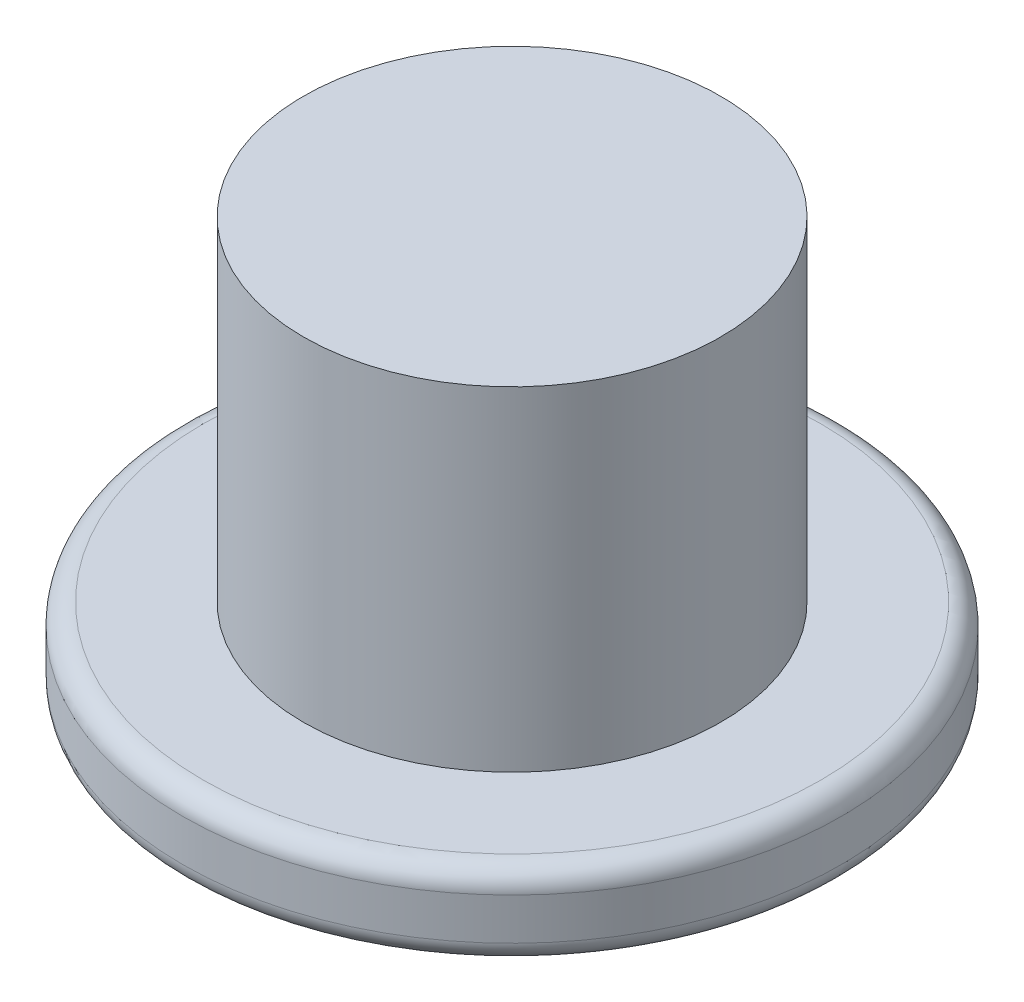
from build123d import *

# Parameters (mm, degrees)
SKETCH1_R           = 7.9
BOSS_EXTRUDE5_DEPTH = 2
SKETCH4_R           = 5
BOSS_EXTRUDE6_DEPTH = 8
CUT_EXTRUDE2_DEPTH  = 0.5
FILLET1_R           = 0.5


with BuildPart() as part:
    # Sketch1 → Boss-Extrude5 (new body)
    with BuildSketch(Plane(origin=(0, 0, 0), x_dir=(1, 0, 0), z_dir=(0, 1, 0))):
        with Locations(Location((-5.408676197, -40.3067379, 0), (0, 0, 270))):
            Circle(SKETCH1_R)
    extrude(amount=BOSS_EXTRUDE5_DEPTH)

    # Sketch4 → Boss-Extrude6 (add)
    with BuildSketch(Plane(origin=(0, 2, 0), x_dir=(1, 0, 0), z_dir=(0, 1, 0))):
        with Locations(Location((-5.408676197, -40.3067379, 0), (0, 0, 270))):
            Circle(SKETCH4_R)
    extrude(amount=BOSS_EXTRUDE6_DEPTH)

    # Sketch5 → Cut-Extrude2 (cut)
    # profile 1 of 2: a face of its own
    with BuildSketch(Plane.XZ):
        with BuildLine():
            Line((-7.395203366, 36.627743896), (-9.326626978, 36.627743896))
            add(Edge.make_bspline(
                [(-9.326626978, 36.627743896), (-9.398611671, 36.62893953), (-9.533540035, 36.63118063), (-9.721593732, 36.659531953), (-9.882699019, 36.700057347), (-10.015508651, 36.762849953), (-10.119951422, 36.844172385), (-10.194282182, 36.945790106), (-10.239550119, 37.065431561), (-10.244297474, 37.151545338), (-10.246765866, 37.196320285)],
                knots=[0, 0, 0, 0, 1.415135186, 2.652534404, 3.734544985, 4.672554218, 5.523260805, 6.310976397, 7.121790439, 8, 8, 8, 8], degree=3))
            add(Edge.make_bspline(
                [(-10.246765866, 37.196320285), (-10.243998068, 37.246880508), (-10.238727183, 37.343165345), (-10.190466013, 37.478040113), (-10.109170063, 37.591156604), (-9.997108837, 37.684714193), (-9.852543086, 37.753164788), (-9.678816187, 37.800974761), (-9.475221022, 37.831046758), (-9.329154177, 37.834140777), (-9.251395496, 37.835787878)],
                knots=[0, 0, 0, 0, 0.905373615, 1.724156773, 2.531277661, 3.379243946, 4.316186145, 5.379299071, 6.604869919, 8, 8, 8, 8], degree=3))
            add(Edge.make_bspline(
                [(-9.251395496, 37.835787878), (-9.218118037, 37.835402612), (-9.148660368, 37.834598475), (-9.079228785, 37.832526752), (-9.043062163, 37.8314476)],
                knots=[0, 0, 0, 0, 0.958208341, 2, 2, 2, 2], degree=3))
            Line((-9.043062163, 37.8314476), (-9.043062163, 42.197767044))
            add(Edge.make_bspline(
                [(-9.043062163, 42.197767044), (-9.07627195, 42.175000143), (-9.139049321, 42.131963245), (-9.229094296, 42.072453597), (-9.309400306, 42.020923773), (-9.382525953, 41.981744301), (-9.443562018, 41.946182155), (-9.498315187, 41.925698888), (-9.542641421, 41.908633246), (-9.570539937, 41.906466396), (-9.582703366, 41.905521674)],
                knots=[0, 0, 0, 0, 1.561944787, 2.952587071, 4.188085884, 5.260224314, 6.172561158, 6.919514454, 7.528920812, 8, 8, 8, 8], degree=3))
            add(Edge.make_bspline(
                [(-9.582703366, 41.905521674), (-9.62586971, 41.907605368), (-9.711372722, 41.911732708), (-9.834918282, 41.94913907), (-9.948331823, 42.012265616), (-10.051370455, 42.094846168), (-10.136897763, 42.194706044), (-10.201251731, 42.304579929), (-10.238775777, 42.423507764), (-10.244085151, 42.505192968), (-10.246765866, 42.546436026)],
                knots=[0, 0, 0, 0, 1.013852114, 2.008217582, 3.003359493, 4.052344806, 5.098380764, 6.079255836, 7.0302116, 8, 8, 8, 8], degree=3))
            add(Edge.make_bspline(
                [(-10.246765866, 42.546436026), (-10.242626904, 42.591950737), (-10.23399707, 42.686849964), (-10.165596234, 42.824961933), (-10.062703976, 42.963842747), (-9.971644073, 43.047104267), (-9.922691792, 43.091864267)],
                knots=[0, 0, 0, 0, 0.833605739, 1.738087287, 2.784033566, 4, 4, 4, 4], degree=3))
            Line((-9.922691792, 43.091864267), (-9.377263552, 43.486829544))
            Line((-9.377263552, 43.486829544), (-8.788432533, 43.959919822))
            add(Edge.make_bspline(
                [(-8.788432533, 43.959919822), (-8.729686688, 43.999861858), (-8.617304787, 44.07627172), (-8.438392764, 44.157341312), (-8.262988102, 44.21096973), (-8.145462893, 44.217267853), (-8.088201052, 44.220336489)],
                knots=[0, 0, 0, 0, 1.121272833, 2.145015919, 3.096195581, 4, 4, 4, 4], degree=3))
            add(Edge.make_bspline(
                [(-8.088201052, 44.220336489), (-8.054268553, 44.218767965), (-7.989751621, 44.21578568), (-7.899443899, 44.19076183), (-7.821955451, 44.15016124), (-7.758821382, 44.091142413), (-7.710617094, 44.015487272), (-7.678099525, 43.923469045), (-7.657845999, 43.81611993), (-7.655451648, 43.739151052), (-7.654173274, 43.698056396)],
                knots=[0, 0, 0, 0, 1.048007274, 1.992609376, 2.873587166, 3.728544433, 4.634673172, 5.621103599, 6.729877163, 8, 8, 8, 8], degree=3))
            add(Edge.make_bspline(
                [(-7.654173274, 43.698056396), (-7.653927207, 43.647417432), (-7.65341394, 43.54179056), (-7.657652871, 43.375920499), (-7.659162961, 43.195509007), (-7.666447064, 43.000255304), (-7.670796966, 42.790400199), (-7.681031343, 42.565756009), (-7.688115451, 42.326458091), (-7.70167787, 42.070521305), (-7.710699694, 41.79316043), (-7.722015306, 41.490364183), (-7.727781096, 41.159471395), (-7.736382851, 40.800714247), (-7.73919812, 40.413426017), (-7.7448814, 39.998225068), (-7.745100584, 39.555500473), (-7.74619974, 39.251200006), (-7.746765866, 39.094468433)],
                knots=[0, 0, 0, 0, 0.527813644, 1.10095664, 1.72938664, 2.408302001, 3.137464797, 3.91720181, 4.752194944, 5.632803057, 6.588542385, 7.64475597, 8.791141156, 10.038040056, 11.38530595, 12.828075392, 14.366283368, 16, 16, 16, 16], degree=3))
            Line((-7.746765866, 39.094468433), (-7.746765866, 37.924040193))
            Line((-7.746765866, 37.924040193), (-7.415457996, 37.924040193))
            add(Edge.make_bspline(
                [(-7.415457996, 37.924040193), (-7.368446742, 37.921994347), (-7.277377999, 37.918031197), (-7.146339977, 37.881935068), (-7.02814323, 37.821911518), (-6.923972292, 37.740453761), (-6.836915042, 37.643032931), (-6.773213613, 37.531286361), (-6.735704321, 37.406990969), (-6.73078569, 37.320517914), (-6.728247348, 37.275892044)],
                knots=[0, 0, 0, 0, 1.070033963, 2.072836576, 3.070927483, 4.073730096, 5.070730524, 6.030736016, 6.983728311, 8, 8, 8, 8], degree=3))
            add(Edge.make_bspline(
                [(-6.728247348, 37.275892044), (-6.730127963, 37.231231312), (-6.733773851, 37.14464898), (-6.772424894, 37.02057837), (-6.833383292, 36.908011653), (-6.91808705, 36.810059971), (-7.018698526, 36.728685964), (-7.133933462, 36.669869158), (-7.260923667, 36.633829575), (-7.349629677, 36.629809337), (-7.395203366, 36.627743896)],
                knots=[0, 0, 0, 0, 1.030309817, 1.997428643, 2.975999118, 3.973155493, 4.973303344, 5.951301239, 6.947458459, 8, 8, 8, 8], degree=3))
        make_face()
    # profile 2 of 2: a face of its own
    with BuildSketch(Plane.XZ):
        with BuildLine():
            add(Edge.make_bspline(
                [(-2.373501978, 36.442558711), (-2.439597493, 36.443778155), (-2.569569797, 36.446176107), (-2.761008881, 36.461869905), (-2.945415788, 36.489938656), (-3.123118843, 36.52658927), (-3.293752699, 36.576294128), (-3.457321113, 36.637487871), (-3.614861491, 36.707661384), (-3.76511097, 36.789669596), (-3.908527497, 36.88154355), (-4.04322282, 36.987129363), (-4.172728308, 37.101623628), (-4.295447484, 37.227013912), (-4.41028209, 37.364433601), (-4.51844426, 37.511832363), (-4.620701389, 37.669909282), (-4.680882789, 37.781814798), (-4.711464941, 37.838681396)],
                knots=[0, 0, 0, 0, 1.101036621, 2.165113118, 3.196701619, 4.206636599, 5.185419256, 6.153861669, 7.113904655, 8.055726016, 9.002740657, 9.947572133, 10.903573382, 11.880673289, 12.867074579, 13.884141148, 14.924792093, 16, 16, 16, 16], degree=3))
            add(Edge.make_bspline(
                [(-4.711464941, 37.838681396), (-4.754896626, 37.927246315), (-4.843309325, 38.107535508), (-4.950451339, 38.395613487), (-5.041716336, 38.70215935), (-5.115902025, 39.027074458), (-5.175881335, 39.370302143), (-5.216997706, 39.732140815), (-5.241692328, 40.113122022), (-5.245048736, 40.373365538), (-5.246765866, 40.50650547)],
                knots=[0, 0, 0, 0, 0.86163265, 1.754002121, 2.682094637, 3.655395029, 4.66495959, 5.72569639, 6.83647195, 8, 8, 8, 8], degree=3))
            add(Edge.make_bspline(
                [(-5.246765866, 40.50650547), (-5.244500916, 40.6213626), (-5.240037474, 40.847706752), (-5.205963944, 41.181288579), (-5.150877531, 41.504171417), (-5.074941427, 41.816966956), (-4.974624265, 42.118651582), (-4.852312308, 42.409075952), (-4.709732377, 42.689833188), (-4.597183117, 42.867021204), (-4.540747348, 42.955868896)],
                knots=[0, 0, 0, 0, 1.065446396, 2.099630748, 3.107335507, 4.102416534, 5.082906438, 6.053454268, 7.02394022, 8, 8, 8, 8], degree=3))
            add(Edge.make_bspline(
                [(-4.540747348, 42.955868896), (-4.505109448, 43.007372484), (-4.434880474, 43.108866797), (-4.321660817, 43.252601421), (-4.203013995, 43.385682656), (-4.079434075, 43.508900115), (-3.952279485, 43.623872846), (-3.819529089, 43.728128368), (-3.680303083, 43.820815187), (-3.538597217, 43.906249973), (-3.391105199, 43.980737217), (-3.238473204, 44.043989711), (-3.081435765, 44.099751264), (-2.918491216, 44.142128623), (-2.751626122, 44.177852207), (-2.579428727, 44.201276083), (-2.402793618, 44.218733855), (-2.283365888, 44.219798634), (-2.223039015, 44.220336489)],
                knots=[0, 0, 0, 0, 1.089001194, 2.146014127, 3.179577203, 4.187716666, 5.179502559, 6.159265929, 7.119926927, 8.086463806, 9.035375073, 9.990160863, 10.958261042, 11.930674461, 12.915914311, 13.924053774, 14.951371286, 16, 16, 16, 16], degree=3))
            add(Edge.make_bspline(
                [(-2.223039015, 44.220336489), (-2.109962382, 44.217300968), (-1.888746884, 44.211362479), (-1.567260144, 44.156162969), (-1.265204003, 44.068444856), (-0.9832604, 43.944098347), (-0.720135204, 43.785223817), (-0.477870377, 43.58934066), (-0.253304827, 43.359568627), (-0.126416544, 43.183352065), (-0.061580681, 43.093311026)],
                knots=[0, 0, 0, 0, 1.065421073, 2.084317927, 3.065587267, 4.024520138, 4.981370049, 5.954971245, 6.955055573, 8, 8, 8, 8], degree=3))
            add(Edge.make_bspline(
                [(-0.061580681, 43.093311026), (-0.009538346, 43.012640523), (0.094562097, 42.851275067), (0.225908941, 42.593280582), (0.337442397, 42.323770881), (0.428885265, 42.04175424), (0.499730745, 41.747151758), (0.549777081, 41.440080052), (0.580991343, 41.121060866), (0.584689252, 40.904436739), (0.586567467, 40.794410563)],
                knots=[0, 0, 0, 0, 0.949659157, 1.899606148, 2.860462492, 3.834038165, 4.83079677, 5.856383007, 6.911229405, 8, 8, 8, 8], degree=3))
            add(Edge.make_bspline(
                [(0.586567467, 40.794410563), (0.58448588, 40.618810292), (0.580449884, 40.278338252), (0.545484412, 39.784749532), (0.488524776, 39.324766749), (0.40845338, 38.898704104), (0.304685988, 38.506273302), (0.178283526, 38.147513525), (0.027548222, 37.822634527), (-0.14567533, 37.531053439), (-0.343961564, 37.274648902), (-0.563267666, 37.0499372), (-0.809043848, 36.862308215), (-1.077136555, 36.707265062), (-1.36914741, 36.58891245), (-1.683179641, 36.503039823), (-2.020770138, 36.452242687), (-2.253727389, 36.445847028), (-2.373501978, 36.442558711)],
                knots=[0, 0, 0, 0, 1.410768719, 2.735344897, 3.97339736, 5.133070797, 6.215826799, 7.231830758, 8.185260544, 9.089012029, 9.950857309, 10.783804673, 11.604540534, 12.427350082, 13.264917127, 14.128798245, 15.03792469, 16, 16, 16, 16], degree=3))
        make_face()
        with BuildLine():
            add(Edge.make_bspline(
                [(-2.259207996, 42.924040193), (-2.323549729, 42.922145887), (-2.450491722, 42.918408549), (-2.635327546, 42.878841998), (-2.810497624, 42.817984875), (-2.976496245, 42.733545066), (-3.13018731, 42.62132395), (-3.2758714, 42.48741355), (-3.411496788, 42.328554633), (-3.489327847, 42.208855278), (-3.529462626, 42.14713047)],
                knots=[0, 0, 0, 0, 0.987720428, 1.948707218, 2.891188167, 3.832764918, 4.799652197, 5.806957348, 6.869123932, 8, 8, 8, 8], degree=3))
            add(Edge.make_bspline(
                [(-3.529462626, 42.14713047), (-3.563189394, 42.090247649), (-3.630707502, 41.976373099), (-3.715195515, 41.796348204), (-3.78821179, 41.610433114), (-3.847518602, 41.417425085), (-3.893513598, 41.217704249), (-3.927330331, 41.011429842), (-3.945647947, 40.798119122), (-3.948846322, 40.653624505), (-3.95046957, 40.580290193)],
                knots=[0, 0, 0, 0, 0.965078813, 1.932005355, 2.899623887, 3.879614671, 4.877106227, 5.890011682, 6.929132817, 8, 8, 8, 8], degree=3))
            add(Edge.make_bspline(
                [(-3.95046957, 40.580290193), (-3.950237076, 40.484787587), (-3.949785987, 40.299492048), (-3.937110258, 40.030345766), (-3.920648973, 39.778418383), (-3.896303866, 39.543335435), (-3.864042669, 39.324860963), (-3.828058373, 39.122529004), (-3.781440827, 38.937724124), (-3.744159942, 38.821821665), (-3.726221885, 38.766054081)],
                knots=[0, 0, 0, 0, 1.24838878, 2.422141985, 3.521760686, 4.548725799, 5.510782421, 6.408528782, 7.23424831, 8, 8, 8, 8], degree=3))
            add(Edge.make_bspline(
                [(-3.726221885, 38.766054081), (-3.694919564, 38.685118538), (-3.634611454, 38.529185383), (-3.515597352, 38.317835988), (-3.377653457, 38.138771817), (-3.220040924, 37.991995205), (-3.043111792, 37.87810676), (-2.847126226, 37.795496571), (-2.63188434, 37.747443471), (-2.482251641, 37.741771018), (-2.405330681, 37.738855007)],
                knots=[0, 0, 0, 0, 1.155090394, 2.225436224, 3.218966621, 4.155622191, 5.080634948, 6.007876656, 6.975918764, 8, 8, 8, 8], degree=3))
            add(Edge.make_bspline(
                [(-2.405330681, 37.738855007), (-2.340566424, 37.741101005), (-2.214008195, 37.745489991), (-2.030346533, 37.779092073), (-1.85912174, 37.835531727), (-1.70138592, 37.916067479), (-1.556733945, 38.018933566), (-1.423644384, 38.142878839), (-1.304801967, 38.29125208), (-1.197422077, 38.461500993), (-1.103913129, 38.6549649), (-1.023585026, 38.870346747), (-0.953681117, 39.107559382), (-0.898463965, 39.367414271), (-0.855409966, 39.650069142), (-0.823988659, 39.954700391), (-0.805075158, 40.28201589), (-0.803258328, 40.507443858), (-0.802321422, 40.62369297)],
                knots=[0, 0, 0, 0, 0.839850773, 1.641183446, 2.412778331, 3.171043049, 3.929617431, 4.708684097, 5.522617875, 6.388740024, 7.314899046, 8.304914321, 9.368005926, 10.520288666, 11.748457435, 13.075714715, 14.491999149, 16, 16, 16, 16], degree=3))
            add(Edge.make_bspline(
                [(-0.802321422, 40.62369297), (-0.803293043, 40.71680427), (-0.805172657, 40.8969292), (-0.823518199, 41.158009002), (-0.84925, 41.401771932), (-0.890559758, 41.627118741), (-0.939487217, 41.835286458), (-1.004159046, 42.023938828), (-1.07684983, 42.19566715), (-1.162650568, 42.349088895), (-1.260101903, 42.484128203), (-1.3671375, 42.60368504), (-1.488750373, 42.701832651), (-1.620046416, 42.784949819), (-1.764556868, 42.846410451), (-1.919437571, 42.89144289), (-2.085526479, 42.919814377), (-2.200256407, 42.922605852), (-2.259207996, 42.924040193)],
                knots=[0, 0, 0, 0, 1.451310721, 2.807578068, 4.078675786, 5.270246053, 6.377072111, 7.408892681, 8.375345316, 9.280835355, 10.142571817, 10.967410406, 11.774095613, 12.57101741, 13.382488036, 14.212790549, 15.081679558, 16, 16, 16, 16], degree=3))
        make_face(mode=Mode.SUBTRACT)
    extrude(amount=-CUT_EXTRUDE2_DEPTH, mode=Mode.SUBTRACT)

    # Fillet1
    fillet1_edges = [part.edges().sort_by_distance(p)[0] for p in [
        (-5.408676197, 0, 32.4067379),
        (-5.408676197, 2, 32.4067379),
    ]]
    fillet(fillet1_edges, radius=FILLET1_R)


solid = part.part
